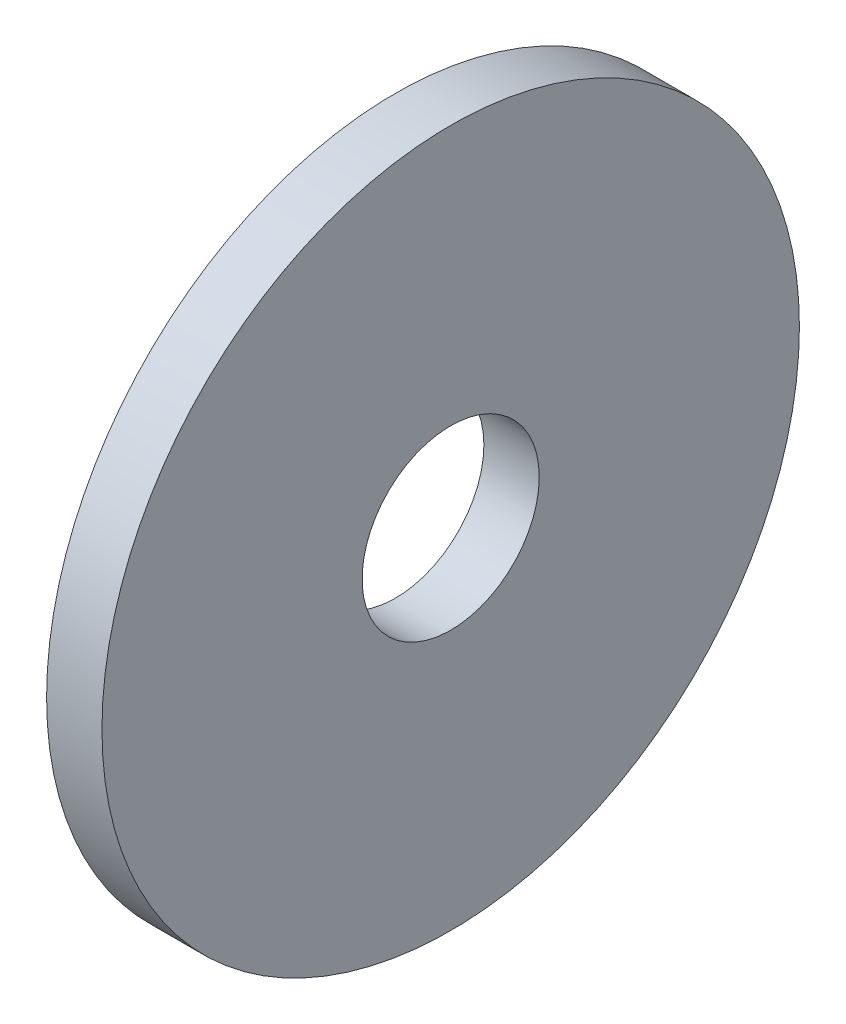
from build123d import *

# Parameters (mm, degrees)
SKETCH_1_R      = 15.75
SKETCH_1_R_2    = 4
EXTRUDE_1_DEPTH = 2.5


with BuildPart() as part:
    # ｽｹｯﾁ1 → ﾎﾞｽ - 押し出し1 (new body)
    with BuildSketch(Plane(origin=(0, 0, 0), x_dir=(0, 0, -1), z_dir=(1, 0, 0))):
        Circle(SKETCH_1_R)
        Circle(SKETCH_1_R_2, mode=Mode.SUBTRACT)
    extrude(amount=EXTRUDE_1_DEPTH)


solid = part.part
